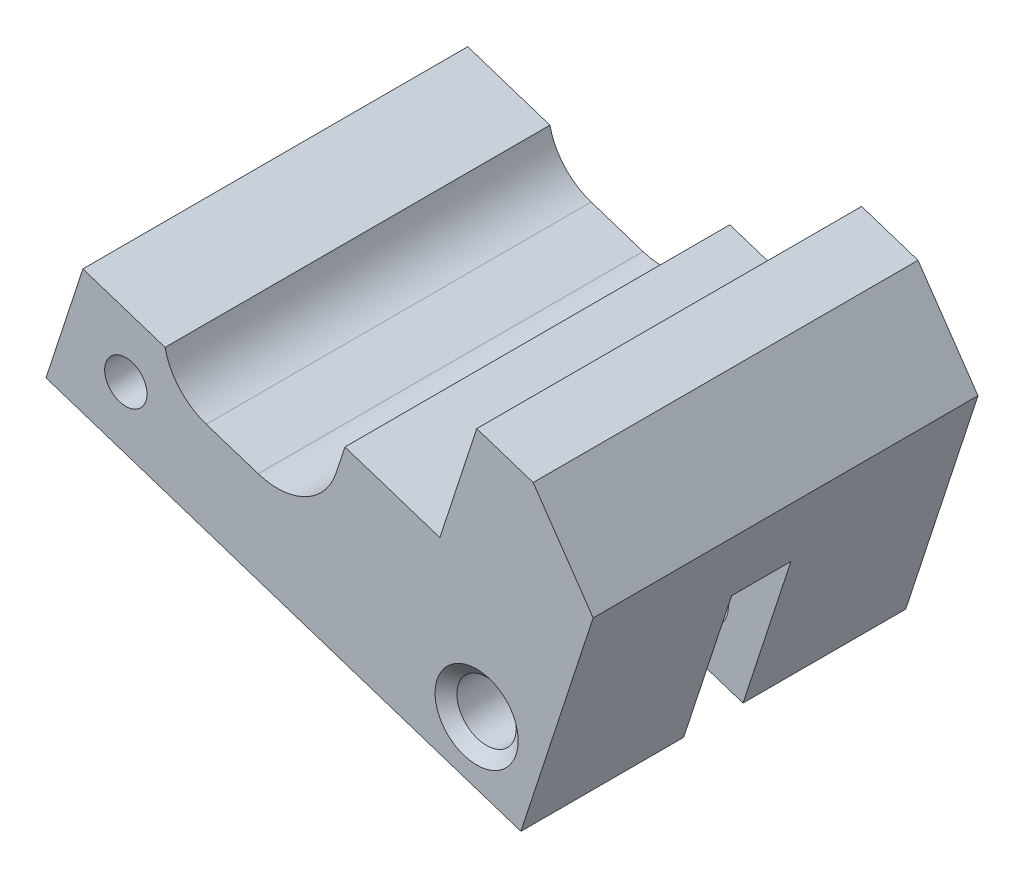
from build123d import *

# Parameters (mm, degrees)
BOSS_EXTRUDE1_START                    = 1.27
BOSS_EXTRUDE1_DEPTH                    = 20.586143296
F_4_40_TAPPED_HOLE1_D                  = 2.2606
F_1_8_0_125_DIAMETER_HOLE1_D           = 3.175
F_1_8_0_125_DIAMETER_HOLE1_CSINK_D     = 4.445
F_1_8_0_125_DIAMETER_HOLE1_CSINK_ANGLE = 100
CUT_EXTRUDE1_DEPTH                     = 8.255
CUT_EXTRUDE2_DEPTH                     = 88.238189659


with BuildPart() as part:
    # Sketch1 → Boss-Extrude1 (new body)
    with BuildSketch(Plane.XY.offset(BOSS_EXTRUDE1_START)):
        Polygon((8.016705611, -68.938838733), (7.029985744, -71.956620849), (0.99442151, -69.983181117), (0.007701644, -73.000963234), (-12.063426824, -69.054083768), (-14.036866557, -75.089648002), (11.365311403, -83.395361493), (15.229120806, -71.578294343), (12.021207594, -66.907776482), (9.003425477, -65.921056616), align=None)
    extrude(amount=BOSS_EXTRUDE1_DEPTH)

    # #4-40 Tapped Hole1 (through all)
    with Locations(Plane.XY.offset(21.856143296)):
        with Locations((-9.766799747, -73.145417099)):
            Hole(F_4_40_TAPPED_HOLE1_D / 2)

    # 1/8 (0.125) Diameter Hole1 (through all)
    with Locations(Plane.XY.offset(21.856143296)):
        with Locations((8.997580837, -79.280779556)):
            CounterSinkHole(F_1_8_0_125_DIAMETER_HOLE1_D / 2, F_1_8_0_125_DIAMETER_HOLE1_CSINK_D / 2, counter_sink_angle=F_1_8_0_125_DIAMETER_HOLE1_CSINK_ANGLE)

    # Sketch6 → Cut-Extrude1 (cut)
    with BuildSketch(Plane(origin=(-23.536376178, -71.983607041, 0), x_dir=(0.9504825565073892, -0.3107779106937582, 0), z_dir=(-0.31077791069375826, -0.9504825565073893, 0))):
        with BuildLine():
            Line((36.719966444, 13.150571648), (26.559966444, 13.150571648))
            ThreePointArc((26.559966444, 13.150571648), (24.972466444, 11.563071648), (26.559966444, 9.975571648))
            Line((26.559966444, 9.975571648), (36.719966444, 9.975571648))
            ThreePointArc((36.719966444, 9.975571648), (38.307466444, 11.563071648), (36.719966444, 13.150571648))
        make_face()
    extrude(amount=-CUT_EXTRUDE1_DEPTH, mode=Mode.SUBTRACT)

    # Sketch8 → Cut-Extrude2 (cut, through all)
    with BuildSketch(Plane.XY.offset(21.856143296)):
        with BuildLine():
            Line((-5.462102823, -72.94952157), (-2.685743275, -73.857303847))
            ThreePointArc((-2.685743275, -73.857303847), (-0.165929608, -73.663685373), (1.478938787, -71.744999106))
            ThreePointArc((1.478938787, -71.744999106), (1.632876898, -70.97000506), (1.598291814, -70.180627719))
            Line((1.598291814, -70.180627719), (0.99442151, -69.983181117))
            Line((0.99442151, -69.983181117), (0.007701644, -73.000963234))
            Line((0.007701644, -73.000963234), (-7.667023508, -70.491569419))
            ThreePointArc((-7.667023508, -70.491569419), (-6.893866312, -72.015948853), (-5.462102823, -72.94952157))
        make_face()
        with BuildLine():
            ThreePointArc((1.598291814, -70.180627719), (1.632876898, -70.97000506), (1.478938787, -71.744999106))
            Line((1.478938787, -71.744999106), (1.952564323, -70.29646369))
            Line((1.952564323, -70.29646369), (1.598291814, -70.180627719))
        make_face()
    extrude(amount=-CUT_EXTRUDE2_DEPTH, mode=Mode.SUBTRACT)


solid = part.part
